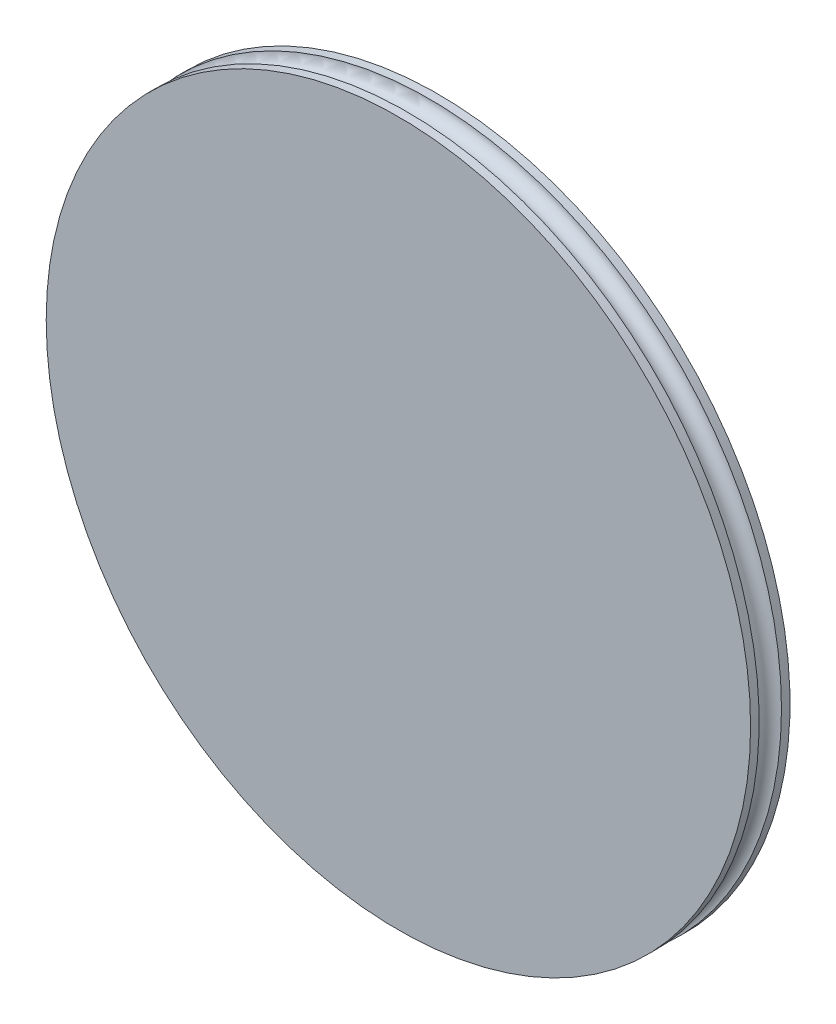
from build123d import *

# Parameters (mm, degrees)
SKETCH_1_R      = 5.75
SKETCH_1_R_2    = 2.83
EXTRUDE_1_DEPTH = 11
SKETCH_2_R      = 26.8
EXTRUDE_2_DEPTH = 1.5
EXTRUDE_START   = 1.5
SKETCH_3_R      = 26.8
SKETCH_3_R_2    = 24.8
EXTRUDE_3_DEPTH = 1.5
SKETCH_4_R      = 0.85


with BuildPart() as part:
    # Эскиз1 → Бобышка-Вытянуть1 (new body)
    # profile 1 of 3: a face of its own
    with BuildSketch(Plane.XY):
        Circle(SKETCH_1_R)
        Circle(SKETCH_1_R_2, mode=Mode.SUBTRACT)
    # profile 2 of 3: a face of its own
    with BuildSketch(Plane.XY):
        with BuildLine():
            ThreePointArc((2.002223764, 2), (0, 2.83), (-2.002223764, 2))
            Line((-2.002223764, 2), (2.002223764, 2))
        make_face()
    # profile 3 of 3: a face of its own
    with BuildSketch(Plane.XY):
        with BuildLine():
            Line((2.002223764, -2), (-2.002223764, -2))
            ThreePointArc((-2.002223764, -2), (0, -2.83), (2.002223764, -2))
        make_face()
    extrude(amount=EXTRUDE_1_DEPTH)

    # Эскиз2 → Бобышка-Вытянуть2 (add)
    with BuildSketch(Plane.XY.offset(11)):
        Circle(SKETCH_2_R)
    extrude(amount=EXTRUDE_2_DEPTH)

    # Эскиз3 → Бобышка-Вытянуть3 (add)
    with BuildSketch(Plane(origin=(0, 0, 11), x_dir=(-1, 0, 0), z_dir=(0, 0, -1)).offset(EXTRUDE_START)):
        Circle(SKETCH_3_R)
        Circle(SKETCH_3_R_2, mode=Mode.SUBTRACT)
    extrude(amount=-EXTRUDE_3_DEPTH)

    # Эскиз4 → Вырез-Повернуть1 (revolve, cut)
    with BuildSketch(Plane(origin=(0, 0, 0), x_dir=(0, 0, -1), z_dir=(1, 0, 0)), mode=Mode.PRIVATE) as cut_revolve_1_sk:
        with Locations((-11, 26.8)):
            Circle(SKETCH_4_R)
    revolve(cut_revolve_1_sk.sketch.rotate(Axis((0, 0, 11), (0, 0, -1)), 270), axis=Axis((0, 0, 11), (0, 0, -1)), mode=Mode.SUBTRACT)


solid = part.part
